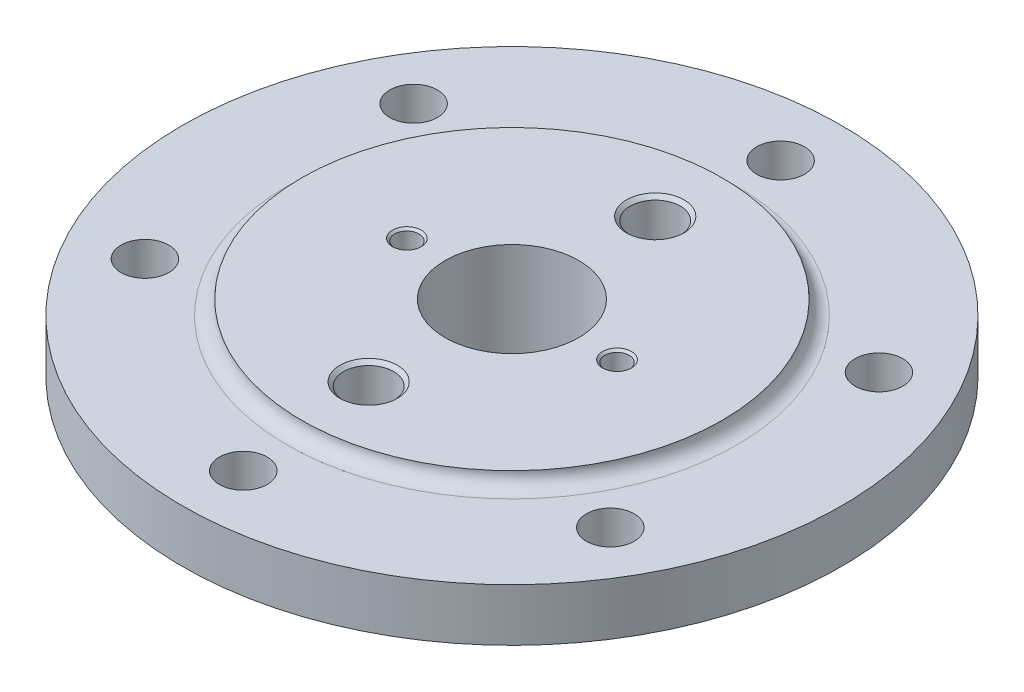
from build123d import *

# Parameters (mm, degrees)
SKETCH2_R                    = 10
CUT_EXTRUDE1_DEPTH           = 230.761019694
M24_TAPPED_HOLE1_D           = 21
M24_TAPPED_HOLE1_DEPTH       = 27
M24_TAPPED_HOLE1_CSINK_D     = 24.05
M24_TAPPED_HOLE1_CSINK_ANGLE = 90
M24_TAPPED_HOLE1_TIP         = 6.3090365
M12_TAPPED_HOLE1_D           = 10.2
M12_TAPPED_HOLE1_DEPTH       = 17.25
M12_TAPPED_HOLE1_CSINK_D     = 12.05
M12_TAPPED_HOLE1_CSINK_ANGLE = 90
M12_TAPPED_HOLE1_TIP         = 3.064389157


with BuildPart() as part:
    # Sketch1 → Revolve1 (revolve)
    with BuildSketch(Plane.XY, mode=Mode.PRIVATE) as revolve1_sk:
        with BuildLine():
            Line((5.306451613, -6.774193548), (-15.693548387, -6.774193548))
            Line((-15.693548387, -6.774193548), (-15.693548387, 10.142902683))
            Line((-15.693548387, 10.142902683), (-1.693548387, 18.225806452))
            Line((-1.693548387, 18.225806452), (-1.693548387, 74.225806452))
            Line((-1.693548387, 74.225806452), (58.306451613, 74.225806452))
            ThreePointArc((58.306451613, 74.225806452), (60.063810926, 69.983165764), (64.306451613, 68.225806452))
            Line((64.306451613, 68.225806452), (108.306451613, 68.225806452))
            Line((108.306451613, 68.225806452), (108.306451613, 46.225806452))
            Line((108.306451613, 46.225806452), (51.306451613, 46.225806452))
            Line((51.306451613, 46.225806452), (51.306451613, 40.225806452))
            Line((51.306451613, 40.225806452), (5.306451613, -6.774193548))
        make_face()
    revolve(revolve1_sk.sketch.rotate(Axis((-29.693548387, 26.362903226, 0), (0, -1, 0)), 180), axis=Axis((-29.693548387, 26.362903226, 0), (0, -1, 0)))

    # Sketch2 → Cut-Extrude1 (cut, through all)
    with BuildSketch(Plane(origin=(0, 68.225806452, 0), x_dir=(1, 0, 0), z_dir=(0, 1, 0))):
        with Locations(Location((-29.693548387, 112.5, 0), (0, 0, 180))):
            Circle(SKETCH2_R)
        with Locations(Location((67.734309539, 56.25, 0), (0, 0, 180))):
            Circle(SKETCH2_R)
        with Locations(Location((67.734309539, -56.25, 0), (0, 0, 180))):
            Circle(SKETCH2_R)
        with Locations(Location((-29.693548387, -112.5, 0), (0, 0, 180))):
            Circle(SKETCH2_R)
        with Locations(Location((-127.121406313, -56.25, 0), (0, 0, 180))):
            Circle(SKETCH2_R)
        with Locations(Location((-127.121406313, 56.25, 0), (0, 0, 180))):
            Circle(SKETCH2_R)
    extrude(amount=-CUT_EXTRUDE1_DEPTH, mode=Mode.SUBTRACT)

    # M24 Tapped Hole1
    with Locations(Plane(origin=(0, 74.225806452, 0), x_dir=(1, 0, 0), z_dir=(0, 1, 0))):
        with Locations((-29.693548387, 60), (-29.693548387, -60)):
            CounterSinkHole(M24_TAPPED_HOLE1_D / 2, M24_TAPPED_HOLE1_CSINK_D / 2, depth=M24_TAPPED_HOLE1_DEPTH, counter_sink_angle=M24_TAPPED_HOLE1_CSINK_ANGLE)
            with Locations((0, 0, -(M24_TAPPED_HOLE1_DEPTH + M24_TAPPED_HOLE1_TIP / 2))):  # 118° drill point
                Cone(0, M24_TAPPED_HOLE1_D / 2, M24_TAPPED_HOLE1_TIP, mode=Mode.SUBTRACT)

    # M12 Tapped Hole1
    with Locations(Plane(origin=(0, 74.225806452, 0), x_dir=(1, 0, 0), z_dir=(0, 1, 0))):
        with Locations((14.306451613, 0), (-73.693548387, 0)):
            CounterSinkHole(M12_TAPPED_HOLE1_D / 2, M12_TAPPED_HOLE1_CSINK_D / 2, depth=M12_TAPPED_HOLE1_DEPTH, counter_sink_angle=M12_TAPPED_HOLE1_CSINK_ANGLE)
            with Locations((0, 0, -(M12_TAPPED_HOLE1_DEPTH + M12_TAPPED_HOLE1_TIP / 2))):  # 118° drill point
                Cone(0, M12_TAPPED_HOLE1_D / 2, M12_TAPPED_HOLE1_TIP, mode=Mode.SUBTRACT)


solid = part.part
